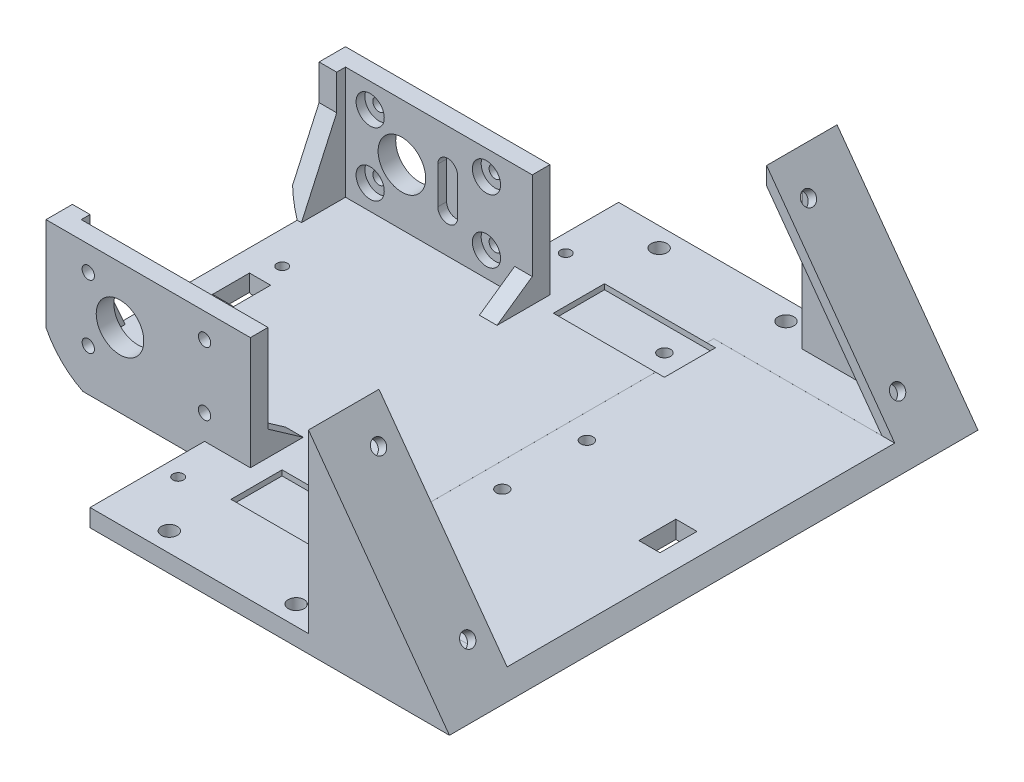
from build123d import *

# Parameters (mm, degrees)
BOSS_EXTRUDE1_DEPTH = 5
BOSS_EXTRUDE2_DEPTH = 32
CUT_EXTRUDE2_DEPTH  = 5
CUT_EXTRUDE3_DEPTH  = 5
SKETCH7_R           = 6.75
SKETCH7_R_2         = 1.75
C_L_NG_C_DEPTH      = 146.27301883
SKETCH8_W           = 40
SKETCH8_H           = 10
BOSS_EXTRUDE3_DEPTH = 55
CUT_EXTRUDE5_DEPTH  = 179.966477308
SKETCH10_R          = 1.75
SKETCH10_R_2        = 2.25
C_L_DEPTH           = 121.768719069
BOSS_EXTRUDE4_REACH = 179.37
CUT_EXTRUDE7_DEPTH  = 5
SKETCH14_R          = 4
CUT_EXTRUDE8_DEPTH  = 2.5
CUT_EXTRUDE9_START  = -2.5
SKETCH15_R          = 4
CUT_EXTRUDE9_DEPTH  = 2.5
SKETCH16_W          = 6
SKETCH16_H          = 10.5
CUT_EXTRUDE10_DEPTH = 5
SKETCH20_W          = 110
SKETCH20_H          = 50.06
CUT_EXTRUDE11_DEPTH = 55
SKETCH22_R          = 2
CUT_EXTRUDE12_DEPTH = 5
CUT_EXTRUDE13_DEPTH = 1.5
CUT_EXTRUDE15_DEPTH = 89
SKETCH26_R          = 1.5
CUT_EXTRUDE16_DEPTH = 5


with BuildPart() as part:
    # Sketch1 → Boss-Extrude1 (new body)
    with BuildSketch(Plane(origin=(0, 0, 0), x_dir=(1, 0, 0), z_dir=(0, 1, 0))):
        Polygon((-25, 75), (-25, 42.5), (-70, 42.5), (-70, -42.5), (-25, -42.5), (-25, -75), (77, -75), (77, 75), align=None)
    extrude(amount=BOSS_EXTRUDE1_DEPTH)

    # Sketch3 → Boss-Extrude2 (add)
    with BuildSketch(Plane(origin=(0, 5, 0), x_dir=(1, 0, 0), z_dir=(0, 1, 0))):
        Polygon((-70, 25), (-65, 25), (-65, 37.5), (-17, 37.5), (-17, 27.5), (-12, 27.5), (-12, 42.5), (-70, 42.5), align=None)
        Polygon((-70, -25), (-70, -42.5), (-12, -42.5), (-12, -27.5), (-17, -27.5), (-17, -37.5), (-65, -37.5), (-65, -25), align=None)
    extrude(amount=BOSS_EXTRUDE2_DEPTH)

    # Sketch5 → Cut-Extrude2 (cut)
    with BuildSketch(Plane.ZY.offset(70)):
        Polygon((-25, 37), (-35, 37), (-35, 27), (-25, 5), align=None)
        Polygon((25, 5), (25, 37), (35, 37), (35, 27), align=None)
    extrude(amount=-CUT_EXTRUDE2_DEPTH, mode=Mode.SUBTRACT)

    # Sketch6 → Cut-Extrude3 (cut)
    with BuildSketch(Plane(origin=(-12, 0, 0), x_dir=(0, 0, -1), z_dir=(1, 0, 0))):
        Polygon((-27.5, 37), (-37.5, 37), (-37.5, 12), (-27.5, 5), align=None)
        Polygon((37.5, 12), (27.5, 5), (27.5, 37), (37.5, 37), align=None)
    extrude(amount=-CUT_EXTRUDE3_DEPTH, mode=Mode.SUBTRACT)

    # Sketch7 → Đục lỗ động cơ (cut, through all)
    with BuildSketch(Plane(origin=(0, 0, -42.5), x_dir=(-1, 0, 0), z_dir=(0, 0, -1))):
        with Locations((49, 21)):
            Circle(SKETCH7_R)
        with Locations((25, 30)):
            Circle(SKETCH7_R_2)
        with Locations((25, 12)):
            Circle(SKETCH7_R_2)
        with Locations((58, 30)):
            Circle(SKETCH7_R_2)
        with Locations((58, 12)):
            Circle(SKETCH7_R_2)
    extrude(amount=-C_L_NG_C_DEPTH, mode=Mode.SUBTRACT)

    # Sketch8 → Boss-Extrude3 (add)
    with BuildSketch(Plane(origin=(0, 5, 0), x_dir=(1, 0, 0), z_dir=(0, 1, 0))):
        with Locations((57, -70)):
            Rectangle(SKETCH8_W, SKETCH8_H)
        with Locations((57, 70)):
            Rectangle(SKETCH8_W, SKETCH8_H)
    extrude(amount=BOSS_EXTRUDE3_DEPTH)

    # Sketch9 → Cut-Extrude5 (cut, through all)
    with BuildSketch(Plane(origin=(0, 0, -75), x_dir=(-1, 0, 0), z_dir=(0, 0, -1))):
        Polygon((-77, 0), (-37, 55.055276819), (-37, 60), (-77, 60), align=None)
    extrude(amount=-CUT_EXTRUDE5_DEPTH, mode=Mode.SUBTRACT)

    # Sketch10 → Đục Lỗ Đế (cut, through all)
    with BuildSketch(Plane(origin=(0, 0, 0), x_dir=(-1, 0, 0), z_dir=(0, -1, 0))):
        with Locations((-29, -12)):
            Circle(SKETCH10_R)
        with Locations((-17, -46)):
            Circle(SKETCH10_R)
        with Locations((-17, 46)):
            Circle(SKETCH10_R)
        with Locations((-29, 12)):
            Circle(SKETCH10_R)
        with Locations((-28, -69.5)):
            Circle(SKETCH10_R_2)
        with Locations((8, -69.5)):
            Circle(SKETCH10_R_2)
        with Locations((8, 69.5)):
            Circle(SKETCH10_R_2)
        with Locations((-28, 69.5)):
            Circle(SKETCH10_R_2)
    extrude(amount=-C_L_DEPTH, mode=Mode.SUBTRACT)

    # Sketch11 → Boss-Extrude4 (add, up to next)
    with BuildSketch(Plane(origin=(0, 0, -75), x_dir=(-1, 0, 0), z_dir=(0, 0, -1)), mode=Mode.PRIVATE) as boss_extrude4_sk1:
        Polygon((-37, 55.055276819), (-37, 50.055276819), (-73.36728736, 0), (-77, 0), align=None)
    boss_extrude4_tool1 = extrude(boss_extrude4_sk1.sketch, amount=-BOSS_EXTRUDE4_REACH, mode=Mode.PRIVATE) - part.part
    add(boss_extrude4_tool1.solids().sort_by_distance((56.106222, 26.297459, -75))[0])

    # Sketch13 → Cut-Extrude7 (cut)
    with BuildSketch(Plane(origin=(50.397154283, 36.615675877, 0), x_dir=(0, 0, -1), z_dir=(0.8090169943749486, 0.5877852522924716, 0))):
        Polygon((-48.866988089, -10.026742728), (-52.405674619, -31.039898345), (-7.731971797, -31.499332186), (-4.277711394, -9.567044368), align=None)
        Polygon((49.555844988, -9.567176647), (3.94811969, -10.026742728), (7.33, -31.499464427), (53.010105385, -31.499464427), align=None)
    extrude(amount=-CUT_EXTRUDE7_DEPTH, mode=Mode.SUBTRACT)

    # Sketch14 → Cut-Extrude8 (cut)
    with BuildSketch(Plane(origin=(0, 0, 37.5), x_dir=(-1, 0, 0), z_dir=(0, 0, -1))):
        with Locations((58, 30)):
            Circle(SKETCH14_R)
        with Locations((25, 30)):
            Circle(SKETCH14_R)
        with Locations((25, 12)):
            Circle(SKETCH14_R)
        with Locations((58, 12)):
            Circle(SKETCH14_R)
        with BuildLine():
            Line((38.8, 26.25), (38.8, 15.75))
            ThreePointArc((38.8, 15.75), (36, 12.95), (33.2, 15.75))
            Line((33.2, 15.75), (33.2, 26.25))
            ThreePointArc((33.2, 26.25), (36, 29.05), (38.8, 26.25))
        make_face()
    extrude(amount=-CUT_EXTRUDE8_DEPTH, mode=Mode.SUBTRACT)

    # Sketch15 → Cut-Extrude9 (cut)
    with BuildSketch(Plane.XY.offset(-37.5).offset(CUT_EXTRUDE9_START)):
        with Locations((-25, 30)):
            Circle(SKETCH15_R)
        with Locations((-25, 12)):
            Circle(SKETCH15_R)
        with Locations((-58, 12)):
            Circle(SKETCH15_R)
        with Locations((-58, 30)):
            Circle(SKETCH15_R)
        with BuildLine():
            Line((-33.2, 26.25), (-33.2, 15.75))
            ThreePointArc((-33.2, 15.75), (-36, 12.95), (-38.8, 15.75))
            Line((-38.8, 15.75), (-38.8, 26.25))
            ThreePointArc((-38.8, 26.25), (-36, 29.05), (-33.2, 26.25))
        make_face()
    extrude(amount=CUT_EXTRUDE9_DEPTH, mode=Mode.SUBTRACT)

    # Sketch16 → Cut-Extrude10 (cut)
    with BuildSketch(Plane(origin=(0, 0, 0), x_dir=(-1, 0, 0), z_dir=(0, -1, 0))):
        with Locations((57, 0)):
            Rectangle(SKETCH16_W, SKETCH16_H)
        with Locations((-64, 0)):
            Rectangle(SKETCH16_W, SKETCH16_H)
    extrude(amount=-CUT_EXTRUDE10_DEPTH, mode=Mode.SUBTRACT)

    # Sketch20 → Cut-Extrude11 (cut)
    with BuildSketch(Plane.ZY.offset(-77)):
        with Locations((0, 30.025276819)):
            Rectangle(SKETCH20_W, SKETCH20_H)
    extrude(amount=CUT_EXTRUDE11_DEPTH, mode=Mode.SUBTRACT)

    # Sketch22 → Cut-Extrude12 (cut)
    with BuildSketch(Plane(origin=(50.397154283, 36.615675877, 0), x_dir=(0, 0, -1), z_dir=(0.8090169943749486, 0.5877852522924716, 0))):
        with Locations((-61, 12.792600242)):
            Circle(SKETCH22_R)
        with Locations((-61, -30.259464427)):
            Circle(SKETCH22_R)
        with Locations((61, -30.259464427)):
            Circle(SKETCH22_R)
        with Locations((61, 12.792600242)):
            Circle(SKETCH22_R)
    extrude(amount=-CUT_EXTRUDE12_DEPTH, mode=Mode.SUBTRACT)

    # Sketch23 → Cut-Extrude13 (cut)
    with BuildSketch(Plane(origin=(0, 5, 0), x_dir=(1, 0, 0), z_dir=(0, 1, 0))):
        Polygon((-7, 38.5), (-6, 38.5), (0, 38.5), (24.5, 38.5), (24.5, 53), (-7, 53), align=None)
        Polygon((24.5, -38.5), (24.5, -53), (-7, -53), (-7, -38.5), (-6, -38.5), (0, -38.5), align=None)
    extrude(amount=-CUT_EXTRUDE13_DEPTH, mode=Mode.SUBTRACT)

    # Sketch25 → Cut-Extrude15 (cut)
    with BuildSketch(Plane.XY.offset(42.5)):
        with BuildLine():
            Line((-70, 10.452488445), (-70, 0))
            Line((-70, 0), (-59.547511555, 0))
            ThreePointArc((-59.547511555, 0), (-65.617009358, 4.382990642), (-70, 10.452488445))
        make_face()
    extrude(amount=-CUT_EXTRUDE15_DEPTH, mode=Mode.SUBTRACT)

    # Sketch26 → Cut-Extrude16 (cut)
    with BuildSketch(Plane.XZ):
        with Locations((-57.011914478, 11.55)):
            Circle(SKETCH26_R)
        with Locations((-57.011914478, -11.55)):
            Circle(SKETCH26_R)
        with Locations((-20, -55)):
            Circle(SKETCH26_R)
        with Locations((-20, 55)):
            Circle(SKETCH26_R)
    extrude(amount=-CUT_EXTRUDE16_DEPTH, mode=Mode.SUBTRACT)


solid = part.part
